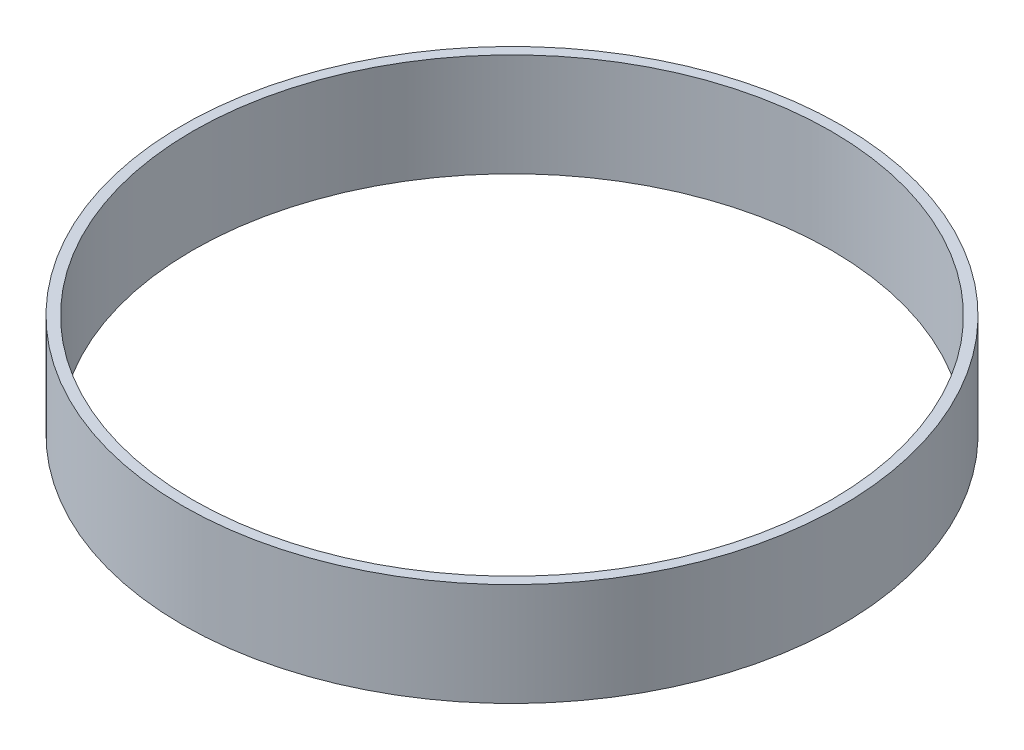
from build123d import *

# Parameters (mm, degrees)
SKETCH1_R           = 160000
SKETCH1_R_2         = 155000
BOSS_EXTRUDE2_DEPTH = 50000


with BuildPart() as part:
    # Sketch1 → Boss-Extrude2 (new body)
    with BuildSketch(Plane(origin=(0, 0, 0), x_dir=(1, 0, 0), z_dir=(0, 1, 0))):
        with Locations(Location((0, 0, 0), (0, 0, 270))):
            Circle(SKETCH1_R)
        with Locations(Location((0, 0, 0), (0, 0, 270))):
            Circle(SKETCH1_R_2, mode=Mode.SUBTRACT)
    extrude(amount=BOSS_EXTRUDE2_DEPTH)


solid = part.part
